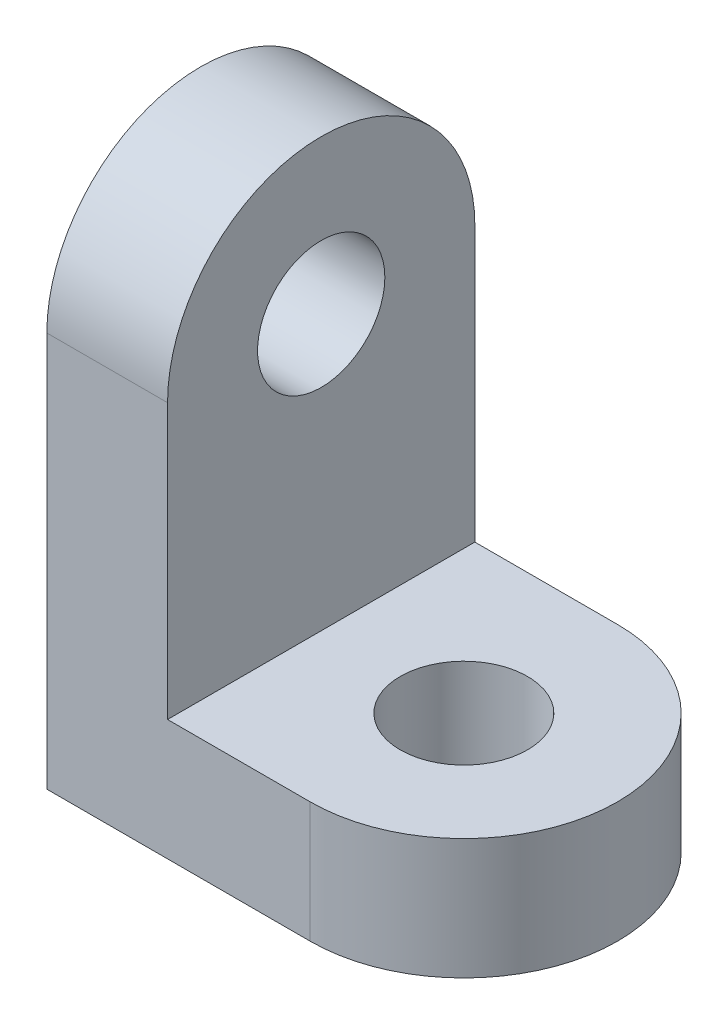
from build123d import *

# Parameters (mm, degrees)
BOSS_EXTRUDE1_DEPTH = 2.75
SKETCH3_R           = 1.45
CUT_EXTRUDE1_DEPTH  = 2.75
BOSS_EXTRUDE2_DEPTH = 2.75
SKETCH6_R           = 1.45
CUT_EXTRUDE2_DEPTH  = 2.75


with BuildPart() as part:
    # Sketch1 → Boss-Extrude1 (new body)
    with BuildSketch(Plane(origin=(0, 0, 0), x_dir=(1, 0, 0), z_dir=(0, 1, 0))):
        with BuildLine():
            Line((-3, 3.5), (3, 3.5))
            ThreePointArc((3, 3.5), (6.5, 0), (3, -3.5))
            Line((3, -3.5), (-3, -3.5))
            Line((-3, -3.5), (-3, 3.5))
        make_face()
    extrude(amount=BOSS_EXTRUDE1_DEPTH)

    # Sketch3 → Cut-Extrude1 (cut)
    with BuildSketch(Plane(origin=(0, 2.75, 0), x_dir=(1, 0, 0), z_dir=(0, 1, 0))):
        with Locations(Location((3, 0, 0), (0, 0, 270))):
            Circle(SKETCH3_R)
    extrude(amount=-CUT_EXTRUDE1_DEPTH, mode=Mode.SUBTRACT)

    # Sketch5 → Boss-Extrude2 (add)
    with BuildSketch(Plane.ZY.offset(3)):
        with BuildLine():
            Line((-3.5, 0), (3.5, 0))
            Line((3.5, 0), (3.5, 9))
            ThreePointArc((3.5, 9), (0, 12.5), (-3.5, 9))
            Line((-3.5, 9), (-3.5, 0))
        make_face()
    extrude(amount=-BOSS_EXTRUDE2_DEPTH)

    # Sketch6 → Cut-Extrude2 (cut)
    with BuildSketch(Plane(origin=(-0.25, 0, 0), x_dir=(0, 0, -1), z_dir=(1, 0, 0))):
        with Locations((0, 9)):
            Circle(SKETCH6_R)
    extrude(amount=-CUT_EXTRUDE2_DEPTH, mode=Mode.SUBTRACT)


solid = part.part
